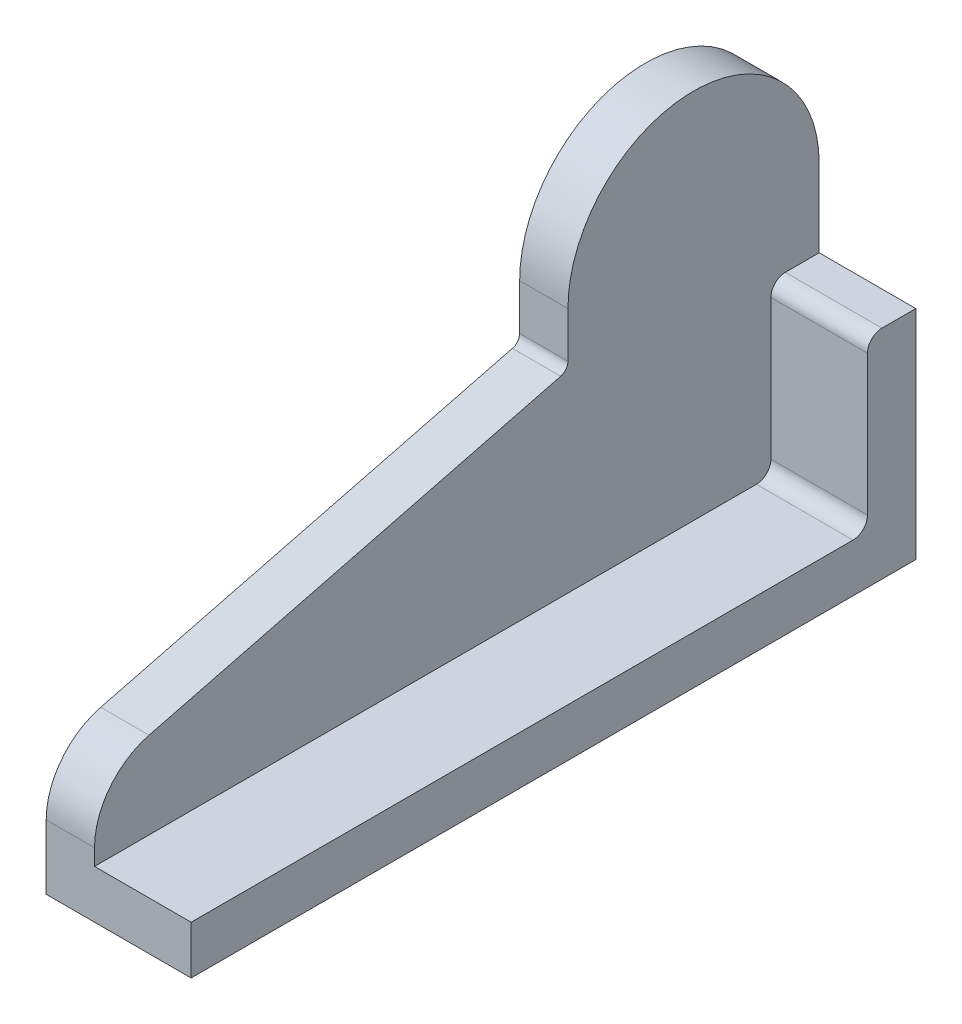
from build123d import *

# Parameters (mm, degrees)
SKETCH1_W                = 82
SKETCH1_H                = 150
BOSS_EXTRUDE1_DEPTH      = 10
SKETCH2_W                = 10
SKETCH2_H                = 45
BOSS_EXTRUDE2_DEPTH      = 82
BOSS_EXTRUDE3_DEPTH      = 42
BOSS_EXTRUDE3_DEPTH_BACK = 10
FILLET3_RADIUS           = 26
FILLET3_LENGTH           = 10
FILLET4_RADIUS           = 26
FILLET4_LENGTH           = 10
BOSS_EXTRUDE4_DEPTH      = 10
BOSS_EXTRUDE5_DEPTH      = 10
FILLET5_R                = 15
FILLET6_R                = 15
SKETCH6_R                = 8
SKETCH6_R_2              = 5.5
CUT_EXTRUDE1_DEPTH       = 131.057679512
FILLET7_R                = 3
FILLET8_R                = 3
FILLET9_R                = 3
FILLET10_R               = 3
FILLET11_R               = 2
SKETCH7_R                = 5.5
CUT_EXTRUDE2_DEPTH       = 116.043470045
SKETCH8_W                = 188.706485039
SKETCH8_H                = 108.604028409
CUT_EXTRUDE3_DEPTH       = 126.678160394
SKETCH9_W                = 188.802330386
SKETCH9_H                = 115.284492933
CUT_EXTRUDE4_DEPTH       = 119.718153624
SKETCH10_W               = 24.217021772
SKETCH10_H               = 20.660675918
SKETCH10_W_2             = 13.71733401
SKETCH10_H_2             = 13.378634406
BOSS_EXTRUDE6_DEPTH      = 10


with BuildPart() as part:
    # Sketch1 → Boss-Extrude1 (new body)
    with BuildSketch(Plane(origin=(0, 0, 0), x_dir=(1, 0, 0), z_dir=(0, 1, 0))):
        Rectangle(SKETCH1_W, SKETCH1_H)
    extrude(amount=BOSS_EXTRUDE1_DEPTH)

    # Sketch2 → Boss-Extrude2 (add, through all)
    with BuildSketch(Plane(origin=(41, 0, 0), x_dir=(0, 0, -1), z_dir=(1, 0, 0))):
        with Locations((70, 22.5)):
            Rectangle(SKETCH2_W, SKETCH2_H)
    extrude(amount=-BOSS_EXTRUDE2_DEPTH)

    # Sketch3 → Boss-Extrude3 (add, two sides: drawn at the far end of the back side and taken through both)
    with BuildSketch(Plane.XY.offset(-65).offset(-BOSS_EXTRUDE3_DEPTH_BACK)):
        Polygon((10, 45), (10, 10), (20, 10), (20, 45), (20, 87), (10, 87), align=None)
        Polygon((-10, 45), (-10, 87), (-20, 87), (-20, 45), (-20, 10), (-10, 10), align=None)
    extrude(amount=BOSS_EXTRUDE3_DEPTH + BOSS_EXTRUDE3_DEPTH_BACK)

    # Fillet3: full round fillet: the end face becomes a half cylinder, R = half its width
    fillet3_face = Plane((15, 87, -49), x_dir=(-1, 0, 0), z_dir=(0, 1, 0))  # on the end face: x along it, z out of the body
    fillet3_slab = fillet3_face.offset(-FILLET3_RADIUS / 2) * Box(FILLET3_LENGTH, 2 * FILLET3_RADIUS, FILLET3_RADIUS, mode=Mode.PRIVATE)  # the body's end, R deep
    fillet3_round = Plane((15, 61, -49), x_dir=(0, 1, 0), z_dir=(-1, 0, 0)) * Cylinder(FILLET3_RADIUS, FILLET3_LENGTH, mode=Mode.PRIVATE)  # its axis R under the face
    add(fillet3_slab - fillet3_round, mode=Mode.SUBTRACT)

    # Fillet4: full round fillet: the end face becomes a half cylinder, R = half its width
    fillet4_face = Plane((-15, 87, -49), x_dir=(-1, 0, 0), z_dir=(0, 1, 0))  # on the end face: x along it, z out of the body
    fillet4_slab = fillet4_face.offset(-FILLET4_RADIUS / 2) * Box(FILLET4_LENGTH, 2 * FILLET4_RADIUS, FILLET4_RADIUS, mode=Mode.PRIVATE)  # the body's end, R deep
    fillet4_round = Plane((-15, 61, -49), x_dir=(0, 1, 0), z_dir=(-1, 0, 0)) * Cylinder(FILLET4_RADIUS, FILLET4_LENGTH, mode=Mode.PRIVATE)  # its axis R under the face
    add(fillet4_slab - fillet4_round, mode=Mode.SUBTRACT)

    # Sketch4 → Boss-Extrude4 (add)
    with BuildSketch(Plane(origin=(20, 0, 0), x_dir=(0, 0, -1), z_dir=(1, 0, 0))):
        Polygon((23, 10), (23, 50), (-75, 25), (-75, 10), align=None)
    extrude(amount=-BOSS_EXTRUDE4_DEPTH)

    # Sketch5 → Boss-Extrude5 (add)
    with BuildSketch(Plane.ZY.offset(20)):
        Polygon((-23, 50), (75, 25), (75, 10), (-23, 10), align=None)
    extrude(amount=-BOSS_EXTRUDE5_DEPTH)

    # Fillet5
    fillet5_edges = [part.edges().sort_by_distance(p)[0] for p in [
        (15, 25, 75),
    ]]
    fillet(fillet5_edges, radius=FILLET5_R)

    # Fillet6
    fillet6_edges = [part.edges().sort_by_distance(p)[0] for p in [
        (-15, 25, 75),
    ]]
    fillet(fillet6_edges, radius=FILLET6_R)

    # Sketch6 → Cut-Extrude1 (cut, through all)
    with BuildSketch(Plane(origin=(20, 0, 0), x_dir=(0, 0, -1), z_dir=(1, 0, 0))):
        with Locations((49, 61)):
            Circle(SKETCH6_R)
        with Locations((-60, 17.5)):
            Circle(SKETCH6_R_2)
    extrude(amount=-CUT_EXTRUDE1_DEPTH, mode=Mode.SUBTRACT)

    # Fillet7
    fillet7_edges = [part.edges().sort_by_distance(p)[0] for p in [
        (30.5, 45, -65),
    ]]
    fillet(fillet7_edges, radius=FILLET7_R)

    # Fillet8
    fillet8_edges = [part.edges().sort_by_distance(p)[0] for p in [
        (0, 45, -65),
    ]]
    fillet(fillet8_edges, radius=FILLET8_R)

    # Fillet9
    fillet9_edges = [part.edges().sort_by_distance(p)[0] for p in [
        (-30.5, 45, -65),
    ]]
    fillet(fillet9_edges, radius=FILLET9_R)

    # Fillet10
    fillet10_edges = [part.edges().sort_by_distance(p)[0] for p in [
        (30.5, 10, -65),
        (0, 10, -65),
        (-30.5, 10, -65),
    ]]
    fillet(fillet10_edges, radius=FILLET10_R)

    # Fillet11
    fillet11_edges = [part.edges().sort_by_distance(p)[0] for p in [
        (15, 50, -23),
        (-15, 50, -23),
    ]]
    fillet(fillet11_edges, radius=FILLET11_R)

    # Sketch7 → Cut-Extrude2 (cut, through all)
    with BuildSketch(Plane(origin=(0, 10, 0), x_dir=(1, 0, 0), z_dir=(0, 1, 0))):
        with Locations(Location((31.5, 45, 0), (0, 0, 270))):
            Circle(SKETCH7_R)
        with Locations(Location((31.5, -15, 0), (0, 0, 270))):
            Circle(SKETCH7_R)
        with Locations(Location((-31.5, -15, 0), (0, 0, 90))):
            Circle(SKETCH7_R)
        with Locations(Location((-31.5, 45, 0), (0, 0, 90))):
            Circle(SKETCH7_R)
    extrude(amount=-CUT_EXTRUDE2_DEPTH, mode=Mode.SUBTRACT)

    # Sketch8 → Cut-Extrude3 (cut, through all)
    with BuildSketch(Plane.ZY.offset(-10)):
        with Locations((0.093142392, 45.704427175)):
            Rectangle(SKETCH8_W, SKETCH8_H)
    extrude(amount=-CUT_EXTRUDE3_DEPTH, mode=Mode.SUBTRACT)

    # Sketch9 → Cut-Extrude4 (cut, through all)
    with BuildSketch(Plane.ZY.offset(20)):
        with Locations((2.13095181, 34.866066892)):
            Rectangle(SKETCH9_W, SKETCH9_H)
    extrude(amount=CUT_EXTRUDE4_DEPTH, mode=Mode.SUBTRACT)

    # Sketch10 → Boss-Extrude6 (add)
    with BuildSketch(Plane.ZY.offset(20)):
        with Locations((-48.857418051, 60.43498026)):
            Rectangle(SKETCH10_W, SKETCH10_H)
        with Locations((60.54255443, 16.996755893)):
            Rectangle(SKETCH10_W_2, SKETCH10_H_2)
    extrude(amount=-BOSS_EXTRUDE6_DEPTH)


solid = part.part
